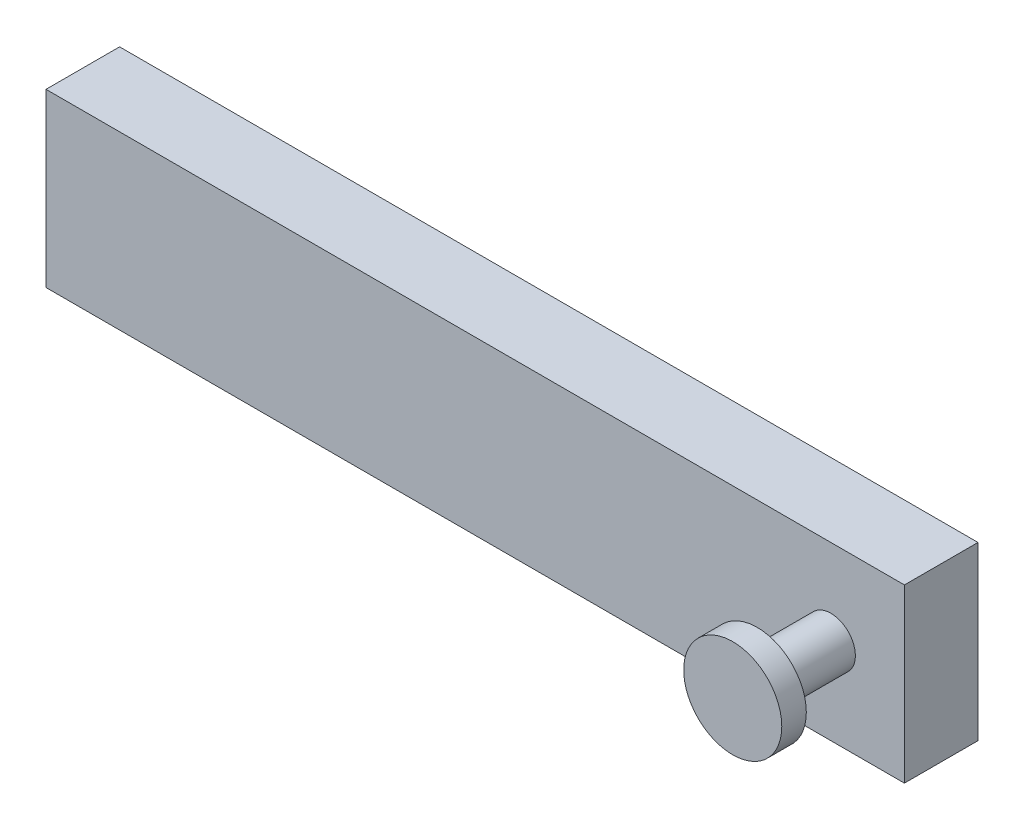
from build123d import *

# Parameters (mm, degrees)
CROQUIS1_W              = 350
CROQUIS1_H              = 70
SALIENTE_EXTRUIR1_DEPTH = 30
CROQUIS2_R              = 20
SALIENTE_EXTRUIR2_DEPTH = 40
CROQUIS4_R              = 20
CROQUIS4_R_2            = 10
CORTAR_EXTRUIR1_DEPTH   = 30


with BuildPart() as part:
    # Croquis1 → Saliente-Extruir1 (new body)
    with BuildSketch(Plane.XY):
        with Locations((175, 35)):
            Rectangle(CROQUIS1_W, CROQUIS1_H)
    extrude(amount=SALIENTE_EXTRUIR1_DEPTH)

    # Croquis2 → Saliente-Extruir2 (add)
    with BuildSketch(Plane.XY.offset(30)):
        with Locations(Location((320, 35, 0), (0, 0, 180))):
            Circle(CROQUIS2_R)
    extrude(amount=SALIENTE_EXTRUIR2_DEPTH)

    # Croquis4 → Cortar-Extruir1 (cut)
    with BuildSketch(Plane.XY.offset(30)):
        with Locations((320, 35)):
            Circle(CROQUIS4_R)
        with Locations((320, 35)):
            Circle(CROQUIS4_R_2, mode=Mode.SUBTRACT)
    extrude(amount=CORTAR_EXTRUIR1_DEPTH, mode=Mode.SUBTRACT)


solid = part.part
